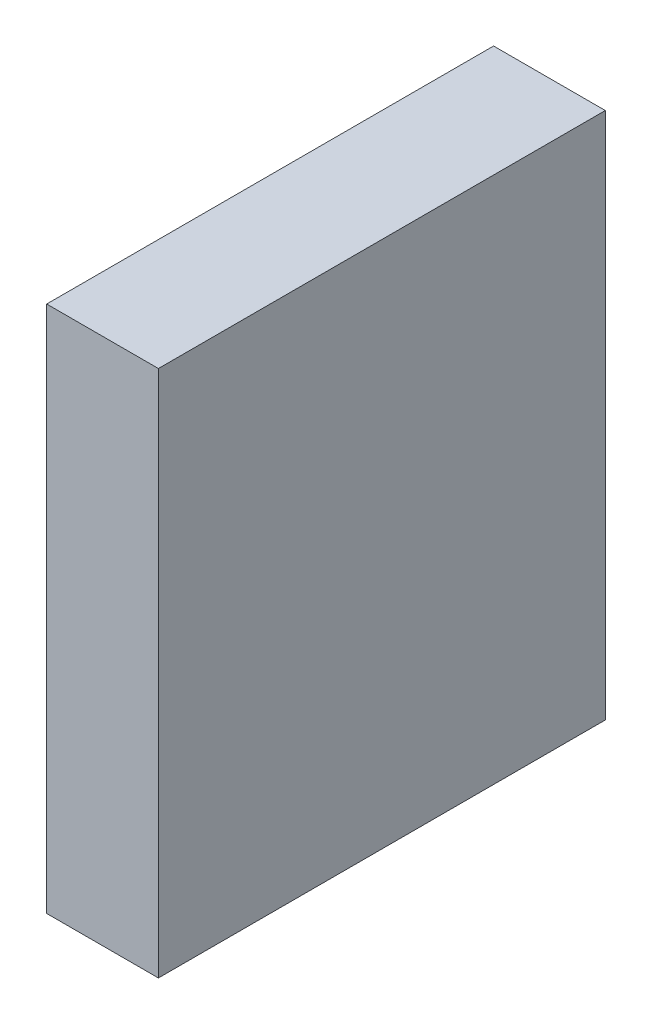
from build123d import *

# Parameters (mm, degrees)
SKETCH1_W           = 2.54
SKETCH1_H           = 10.16
BOSS_EXTRUDE1_DEPTH = 12


with BuildPart() as part:
    # Sketch1 → Boss-Extrude1 (new body)
    with BuildSketch(Plane(origin=(0, 0, 0), x_dir=(1, 0, 0), z_dir=(0, 1, 0))):
        with Locations((-12.192737956, -7.188462815)):
            Rectangle(SKETCH1_W, SKETCH1_H)
    extrude(amount=BOSS_EXTRUDE1_DEPTH)


solid = part.part
